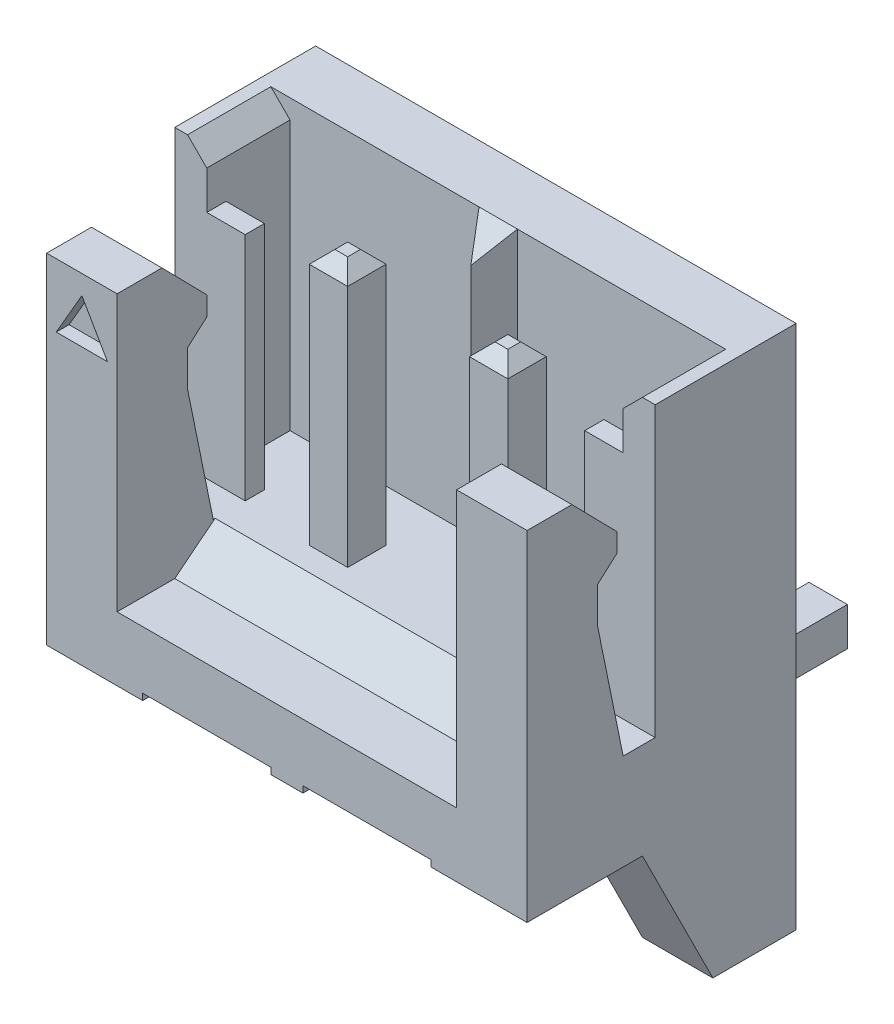
from build123d import *

# Parameters (mm, degrees)
SKETCH_1_W                         = 7.5
SKETCH_1_H                         = 4.2
EXTRUDE_1_DEPTH                    = 6
CUT_EXTRUDE_1_DEPTH                = 5
CUT_EXTRUDE_2_DEPTH                = 11.482843126
EXTRUDE_6_DEPTH                    = 1.1
CUT_EXTRUDE_3_REACH                = 12.483
SKETCH_5_W                         = 5.3
SKETCH_5_H                         = 4.3
EXTRUDE_3_REACH                    = 12.131
EXTRUDE_5_REACH                    = 13.88
SKETCH_11_W                        = 2
SKETCH_11_H                        = 4.2
SKETCH_11_W_2                      = 0.8
SKETCH_11_H_2                      = 0.8
CUT_EXTRUDE_5_DEPTH                = 0.1
SKETCH_15_R                        = 0.05
CUT_EXTRUDE_6_DEPTH                = 0.1
CUT_EXTRUDE_7_DEPTH                = 0.2
SKETCH_7_W                         = 0.6
SKETCH_7_H                         = 0.6
EXTRUDE_4_DEPTH                    = 5.5
SKETCH_18_W                        = 0.6
SKETCH_18_H                        = 0.6
CHAMFER_6_SIZE                     = 0.2
PATTERN_LINEAR_1_COUNT             = 2
PATTERN_LINEAR_1_PITCH             = 2.5
CHAMFER_6_OF_PATTERN_LINEAR_1_SIZE = 0.2
CUT_EXTRUDE_4_REACH                = 12.131
SKETCH_20_W                        = 0.6
SKETCH_20_H                        = 0.3
CUT_EXTRUDE_9_DEPTH                = 0.9
CHAMFER_5_SIZE                     = 0.3
SKETCH_19_R                        = 0.05
CUT_EXTRUDE_8_DEPTH                = 3.2


with BuildPart() as part:
    # Эскиз1 → Бобышка-Вытянуть1 (new body)
    with BuildSketch(Plane(origin=(0, 0, 0), x_dir=(1, 0, 0), z_dir=(0, 1, 0))):
        with Locations((3.75, -2.1)):
            Rectangle(SKETCH_1_W, SKETCH_1_H)
    extrude(amount=EXTRUDE_1_DEPTH)

    # Эскиз2 → Вырез-Вытянуть1 (cut)
    with BuildSketch(Plane(origin=(0, 6, 0), x_dir=(1, 0, 0), z_dir=(0, 1, 0))):
        Polygon((0.5, -0.9), (7, -0.9), (7, -1.9), (6.4, -1.9), (6.4, -3.7), (1.1, -3.7), (1.1, -1.9), (0.5, -1.9), align=None)
    extrude(amount=-CUT_EXTRUDE_1_DEPTH, mode=Mode.SUBTRACT)

    # Эскиз3 → Вырез-Вытянуть2 (cut, through all)
    with BuildSketch(Plane.ZY):
        Polygon((2.2, 6), (2.2, 1.5), (2.7, 1.5), (3.1, 3.459591794), (3.1, 4.021282026), (2.8, 4.285857157), (2.8, 4.585857157), (3.5, 5.3), (4.2, 5.3), (4.2, 6), align=None)
    extrude(amount=-CUT_EXTRUDE_2_DEPTH, mode=Mode.SUBTRACT)

    # Эскиз16 → Бобышка-Вытянуть6 (add)
    with BuildSketch(Plane(origin=(7.5, 0, 0), x_dir=(0, 0, -1), z_dir=(1, 0, 0))):
        Polygon((-2.4, 0), (-1.3, -2.2), (0, -2.2), (0, 0), align=None)
    extrude_6 = extrude(amount=-EXTRUDE_6_DEPTH)

    # Зеркальное отражение2: Бобышка-Вытянуть6 across plane
    add(extrude_6.mirror(Plane(origin=(3.75, 0, 0), x_dir=(0, 0, 1), z_dir=(1, 0, 0))))

    # Эскиз5 → Вырез-Вытянуть3 (cut, up to next)
    with BuildSketch(Plane.XY.offset(4.2), mode=Mode.PRIVATE) as cut_extrude_3_sk1:
        with Locations((3.75, 3.15)):
            Rectangle(SKETCH_5_W, SKETCH_5_H)
    cut_extrude_3_tool1 = extrude(cut_extrude_3_sk1.sketch, amount=-CUT_EXTRUDE_3_REACH, mode=Mode.PRIVATE) & part.part
    add(cut_extrude_3_tool1.solids().sort_by_distance((3.75, 3.15, 4.2))[0], mode=Mode.SUBTRACT)

    # Эскиз6 → Бобышка-Вытянуть3 (add, up to next)
    with BuildSketch(Plane(origin=(0.5, 0, 0), x_dir=(0, 0, -1), z_dir=(1, 0, 0)), mode=Mode.PRIVATE) as extrude_3_sk1:
        Polygon((-3.3, 1), (-2.67, 1.5), (-0.9, 1.5), (-0.9, 1), align=None)
    extrude_3_tool1 = extrude(extrude_3_sk1.sketch, amount=EXTRUDE_3_REACH, mode=Mode.PRIVATE) - part.part
    add(extrude_3_tool1.solids().sort_by_distance((0.5, 1.23741, 1.950432))[0])

    # Эскиз9 → Бобышка-Вытянуть5 (add, up to next)
    with BuildSketch(Plane(origin=(0, 6, 0), x_dir=(1, 0, 0), z_dir=(0, 1, 0)), mode=Mode.PRIVATE) as extrude_5_sk1:
        Polygon((3.45, -0.9), (3.75, -1.328444402), (4.05, -0.9), align=None)
    extrude_5_tool1 = extrude(extrude_5_sk1.sketch, amount=-EXTRUDE_5_REACH, mode=Mode.PRIVATE) - part.part
    add(extrude_5_tool1.solids().sort_by_distance((3.75, 6, 1.042815))[0])

    # Эскиз11 → Вырез-Вытянуть5 (cut)
    with BuildSketch(Plane.XZ):
        with Locations((2.5, 2.1)):
            Rectangle(SKETCH_11_W, SKETCH_11_H)
        with Locations((2.5, 2)):
            Rectangle(SKETCH_11_W_2, SKETCH_11_H_2, mode=Mode.SUBTRACT)
    cut_extrude_5 = extrude(amount=-CUT_EXTRUDE_5_DEPTH, mode=Mode.SUBTRACT)

    # Эскиз15 → Вырез-Вытянуть6 (cut)
    with BuildSketch(Plane.XZ):
        with Locations(Location((2.5, 2, 0), (0, 0, 270))):
            Circle(SKETCH_15_R)
    extrude(amount=-CUT_EXTRUDE_6_DEPTH, mode=Mode.SUBTRACT)

    # Эскиз17 → Вырез-Вытянуть7 (cut)
    with BuildSketch(Plane.XY.offset(4.2)):
        Polygon((0.55, 5), (0.15, 4.307179677), (0.95, 4.307179677), align=None)
    extrude(amount=-CUT_EXTRUDE_7_DEPTH, mode=Mode.SUBTRACT)

    # Эскиз7 → Бобышка-Вытянуть4 (add)
    with BuildSketch(Plane.XZ):
        with Locations((2.5, 2)):
            Rectangle(SKETCH_7_W, SKETCH_7_H)
    extrude_4 = extrude(amount=-EXTRUDE_4_DEPTH)

    # По траектории1: sweep along a curve in space
    with BuildLine() as sweep_1_path:
        Line((2.5, -0.7, 1.3), (2.5, -0.7, -3.2))
        ThreePointArc((2.5, 0, 2), (2.5, -0.494974747, 1.794974747), (2.5, -0.7, 1.3))
    # Эскиз18 → По траектории1 (sweep)
    with BuildSketch(Plane.XZ):
        with Locations((2.5, 2)):
            Rectangle(SKETCH_18_W, SKETCH_18_H)
    sweep_1 = sweep(path=sweep_1_path.line)

    # Фаска6
    chamfer_6_edges = [part.edges().sort_by_distance(p)[0] for p in [
        (2.8, 5.5, 2),
        (2.5, 5.5, 1.7),
        (2.2, 5.5, 2),
        (2.5, 5.5, 2.3),
        (2.8, -0.7, -3.2),
        (2.5, -1, -3.2),
        (2.2, -0.7, -3.2),
        (2.5, -0.4, -3.2),
    ]]
    chamfer(chamfer_6_edges, length=CHAMFER_6_SIZE)

    # Линейный массив1: Вырез-Вытянуть5, Бобышка-Вытянуть4, По траектории1 ×2
    with Locations(*[(i * PATTERN_LINEAR_1_PITCH, 0, 0) for i in range(1, PATTERN_LINEAR_1_COUNT)]):
        add(cut_extrude_5, mode=Mode.SUBTRACT)
        add(extrude_4)
        add(sweep_1)

    # Фаска6 of Линейный массив1
    chamfer_6_of_pattern_linear_1_edges = [part.edges().sort_by_distance(p)[0] for p in [
        (5.3, 5.5, 2),
        (5, 5.5, 1.7),
        (4.7, 5.5, 2),
        (5, 5.5, 2.3),
        (5.3, -0.7, -3.2),
        (5, -1, -3.2),
        (4.7, -0.7, -3.2),
        (5, -0.4, -3.2),
    ]]
    chamfer(chamfer_6_of_pattern_linear_1_edges, length=CHAMFER_6_OF_PATTERN_LINEAR_1_SIZE)

    # Вырез-Вытянуть4: up to this plane
    cut_extrude_4_end = Plane(origin=(4.05, -2.202, 0.9), z_dir=(0.8191520442889916, 0, 0.5735764363510465))
    # Эскиз10 → Вырез-Вытянуть4 (cut, up to the surface)
    with BuildSketch(Plane(origin=(0.5, 0, 0), x_dir=(0, 0, -1), z_dir=(1, 0, 0)), mode=Mode.PRIVATE) as cut_extrude_4_sk1:
        Polygon((-1.4, 6), (-0.9, 6), (-1.4, 5.5), align=None)
    cut_extrude_4_tool1 = split(extrude(cut_extrude_4_sk1.sketch, amount=CUT_EXTRUDE_4_REACH, mode=Mode.PRIVATE), bisect_by=cut_extrude_4_end, keep=Keep.BOTH, mode=Mode.PRIVATE)
    add(cut_extrude_4_tool1.solids().sort_by_distance((0.5, 5.833333, 1.233333))[0], mode=Mode.SUBTRACT)

    # Эскиз20 → Вырез-Вытянуть9 (cut)
    with BuildSketch(Plane(origin=(0, 6, 0), x_dir=(1, 0, 0), z_dir=(0, 1, 0))):
        with Locations((0.8, -2.05)):
            Rectangle(SKETCH_20_W, SKETCH_20_H)
    cut_extrude_9 = extrude(amount=-CUT_EXTRUDE_9_DEPTH, mode=Mode.SUBTRACT)

    # Зеркальное отражение3: Вырез-Вытянуть9 across plane
    add(cut_extrude_9.mirror(Plane(origin=(3.75, 0, 0), x_dir=(0, 0, 1), z_dir=(1, 0, 0))), mode=Mode.SUBTRACT)

    # Фаска5
    chamfer_5_edges = [part.edges().sort_by_distance(p)[0] for p in [
        (0.5, 6, 1.55),
        (7, 6, 1.55),
    ]]
    chamfer(chamfer_5_edges, length=CHAMFER_5_SIZE)

    # Эскиз19 → Вырез-Вытянуть8 (cut)
    with BuildSketch(Plane(origin=(0, 0, 0), x_dir=(-1, 0, 0), z_dir=(0, 0, -1))):
        with Locations(Location((-2.5, -0.7, 0), (0, 0, 270))):
            Circle(SKETCH_19_R)
    extrude(amount=CUT_EXTRUDE_8_DEPTH, mode=Mode.SUBTRACT)


solid = part.part
